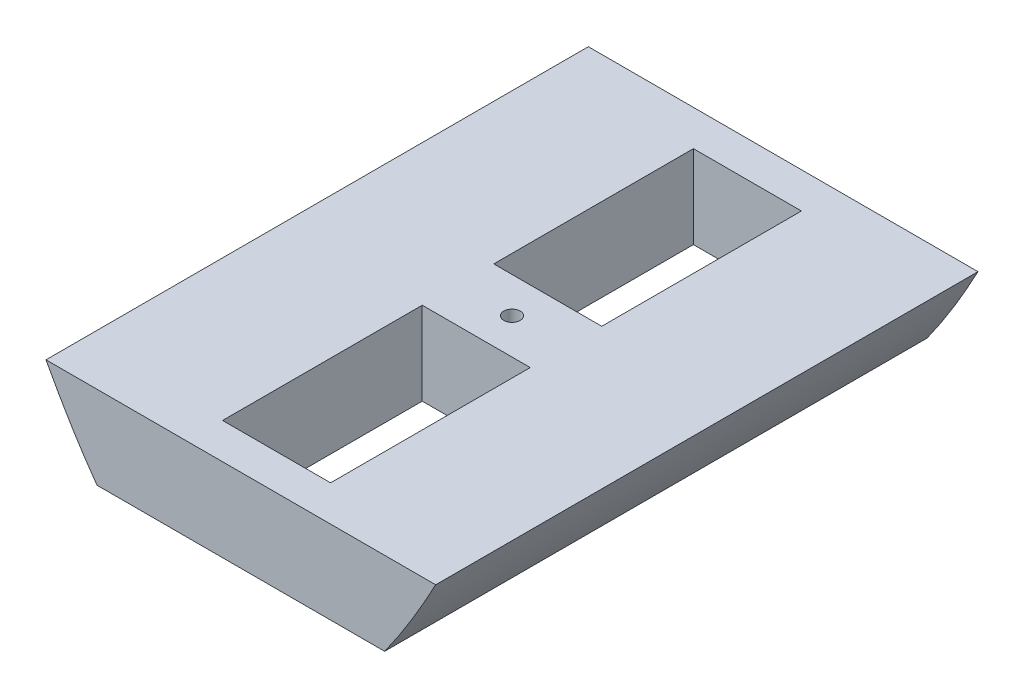
from build123d import *

# Parameters (mm, degrees)
BOSS_EXTRUDE2_DEPTH = 331.382
SKETCH3_R           = 5
SKETCH3_W           = 66
SKETCH3_H           = 122
CUT_EXTRUDE2_DEPTH  = 377.924435453
SKETCH4_W           = 180
SKETCH4_H           = 60.8
CUT_EXTRUDE3_DEPTH  = 377.924435453
SKETCH5_W           = 260
SKETCH5_H           = 20
CUT_EXTRUDE4_DEPTH  = 377.924435453


with BuildPart() as part:
    # Sketch2 → Boss-Extrude2 (new body)
    with BuildSketch(Plane.XY):
        with BuildLine():
            Line((-127, 127), (127, 127))
            add(Edge.make_bspline(
                [(-127, 127), (0, -127), (127, 127)],
                knots=[0.056028396, 0.056028396, 0.056028396, 0.943971604, 0.943971604, 0.943971604], degree=2))
        make_face()
    extrude(amount=BOSS_EXTRUDE2_DEPTH)

    # Sketch3 → Cut-Extrude2 (cut, through all)
    with BuildSketch(Plane(origin=(0, 127, 0), x_dir=(1, 0, 0), z_dir=(0, 1, 0))):
        with Locations(Location((0, -165.691, 0), (0, 0, 270))):
            Circle(SKETCH3_R)
        with Locations((0, -82.8455)):
            Rectangle(SKETCH3_W, SKETCH3_H)
        with Locations((0, -248.5365)):
            Rectangle(SKETCH3_W, SKETCH3_H)
    extrude(amount=-CUT_EXTRUDE2_DEPTH, mode=Mode.SUBTRACT)

    # Sketch4 → Cut-Extrude3 (cut, through all)
    with BuildSketch(Plane(origin=(0, 0, 0), x_dir=(-1, 0, 0), z_dir=(0, 0, -1))):
        with Locations((0, 30.4)):
            Rectangle(SKETCH4_W, SKETCH4_H)
    extrude(amount=-CUT_EXTRUDE3_DEPTH, mode=Mode.SUBTRACT)

    # Sketch5 → Cut-Extrude4 (cut, through all)
    with BuildSketch(Plane.XY.offset(331.382)):
        with Locations((0, 121.6)):
            Rectangle(SKETCH5_W, SKETCH5_H)
    extrude(amount=-CUT_EXTRUDE4_DEPTH, mode=Mode.SUBTRACT)


solid = part.part
